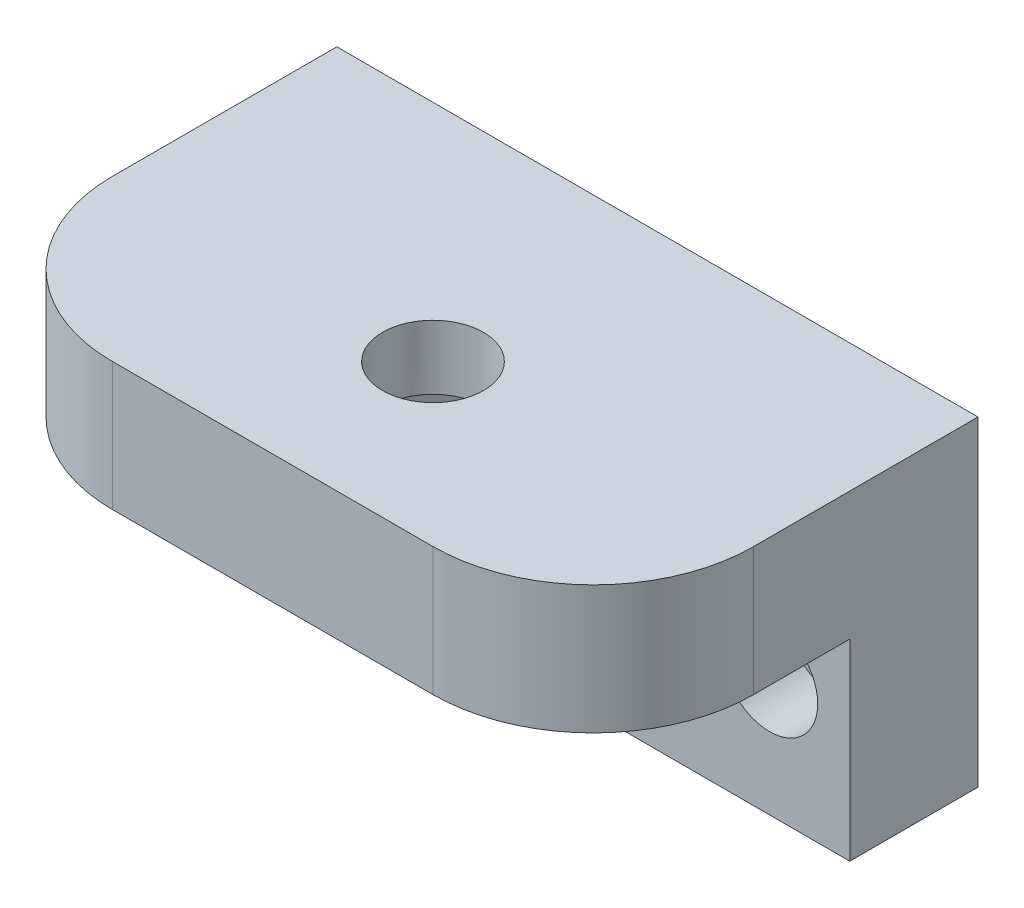
from build123d import *

# Parameters (mm, degrees)
SKETCH1_W               = 40
SKETCH1_H               = 20
BOSS_EXTRUDE1_DEPTH     = 8
SKETCH2_W               = 40
SKETCH2_H               = 8
BOSS_EXTRUDE2_DEPTH     = 16
SKETCH4_R               = 3.15
CUT_EXTRUDE1_DEPTH      = 38.094473982
SKETCH5_R               = 1.6
CUT_EXTRUDE2_DEPTH      = 8
SKETCH6_R               = 1.6
CUT_EXTRUDE3_DEPTH      = 8
CUT_EXTRUDE4_DEPTH      = 33.802438934
CUT_EXTRUDE4_DEPTH_BACK = 1.6
SKETCH9_R               = 3
CUT_EXTRUDE5_DEPTH      = 4
SKETCH10_R              = 3
CUT_EXTRUDE6_DEPTH      = 4
CUT_EXTRUDE7_DEPTH      = 4
FILLET1_R               = 10


with BuildPart() as part:
    # Sketch1 → Boss-Extrude1 (new body)
    with BuildSketch(Plane.XY):
        Rectangle(SKETCH1_W, SKETCH1_H)
    extrude(amount=BOSS_EXTRUDE1_DEPTH)

    # Sketch2 → Boss-Extrude2 (add)
    with BuildSketch(Plane.XY.offset(8)):
        with Locations((0, 6)):
            Rectangle(SKETCH2_W, SKETCH2_H)
    extrude(amount=BOSS_EXTRUDE2_DEPTH)

    # Sketch4 → Cut-Extrude1 (cut, through all)
    with BuildSketch(Plane(origin=(0, 10, 0), x_dir=(1, 0, 0), z_dir=(0, 1, 0))):
        with Locations(Location((0, -14, 0), (0, 0, 270))):
            Circle(SKETCH4_R)
    extrude(amount=-CUT_EXTRUDE1_DEPTH, mode=Mode.SUBTRACT)

    # Sketch5 → Cut-Extrude2 (cut)
    with BuildSketch(Plane(origin=(0, 0, 0), x_dir=(-1, 0, 0), z_dir=(0, 0, -1))):
        with Locations((-15, -2.5)):
            Circle(SKETCH5_R)
    extrude(amount=-CUT_EXTRUDE2_DEPTH, mode=Mode.SUBTRACT)

    # Sketch6 → Cut-Extrude3 (cut)
    with BuildSketch(Plane(origin=(0, 0, 0), x_dir=(-1, 0, 0), z_dir=(0, 0, -1))):
        with Locations((15, -2.5)):
            Circle(SKETCH6_R)
    extrude(amount=-CUT_EXTRUDE3_DEPTH, mode=Mode.SUBTRACT)

    # Sketch7 → Cut-Extrude4 (cut, two sides: drawn at the far end of the back side and taken through both)
    with BuildSketch(Plane(origin=(0, 0, 0), x_dir=(-1, 0, 0), z_dir=(0, 0, -1)).offset(-CUT_EXTRUDE4_DEPTH_BACK)):
        Polygon((-11, -93.783466983), (-11, -10), (-11, 2.5), (-7.5, 2.5), (-7.5, 6.5), (7.5, 6.5), (7.5, 2.5), (11, 2.5), (11, -10), (11, -93.783466983), (11, -261.350400948), (-11, -261.350400948), align=None)
    extrude(amount=CUT_EXTRUDE4_DEPTH + CUT_EXTRUDE4_DEPTH_BACK, mode=Mode.SUBTRACT)

    # Sketch9 → Cut-Extrude5 (cut)
    with BuildSketch(Plane.XY.offset(8)):
        with Locations((-15, -2.5)):
            Circle(SKETCH9_R)
    extrude(amount=-CUT_EXTRUDE5_DEPTH, mode=Mode.SUBTRACT)

    # Sketch10 → Cut-Extrude6 (cut)
    with BuildSketch(Plane.XY.offset(8)):
        with Locations((15, -2.5)):
            Circle(SKETCH10_R)
    extrude(amount=-CUT_EXTRUDE6_DEPTH, mode=Mode.SUBTRACT)

    # Sketch11 → Cut-Extrude7 (cut)
    with BuildSketch(Plane.XZ.offset(-2)):
        Polygon((6.062177826, 14), (3.031088913, 19.25), (-3.031088913, 19.25), (-6.062177826, 14), (-3.031088913, 8.75), (3.031088913, 8.75), align=None)
    extrude(amount=-CUT_EXTRUDE7_DEPTH, mode=Mode.SUBTRACT)

    # Fillet1
    fillet1_edges = [part.edges().sort_by_distance(p)[0] for p in [
        (-20, 6, 24),
        (20, 6, 24),
    ]]
    fillet(fillet1_edges, radius=FILLET1_R)


solid = part.part
